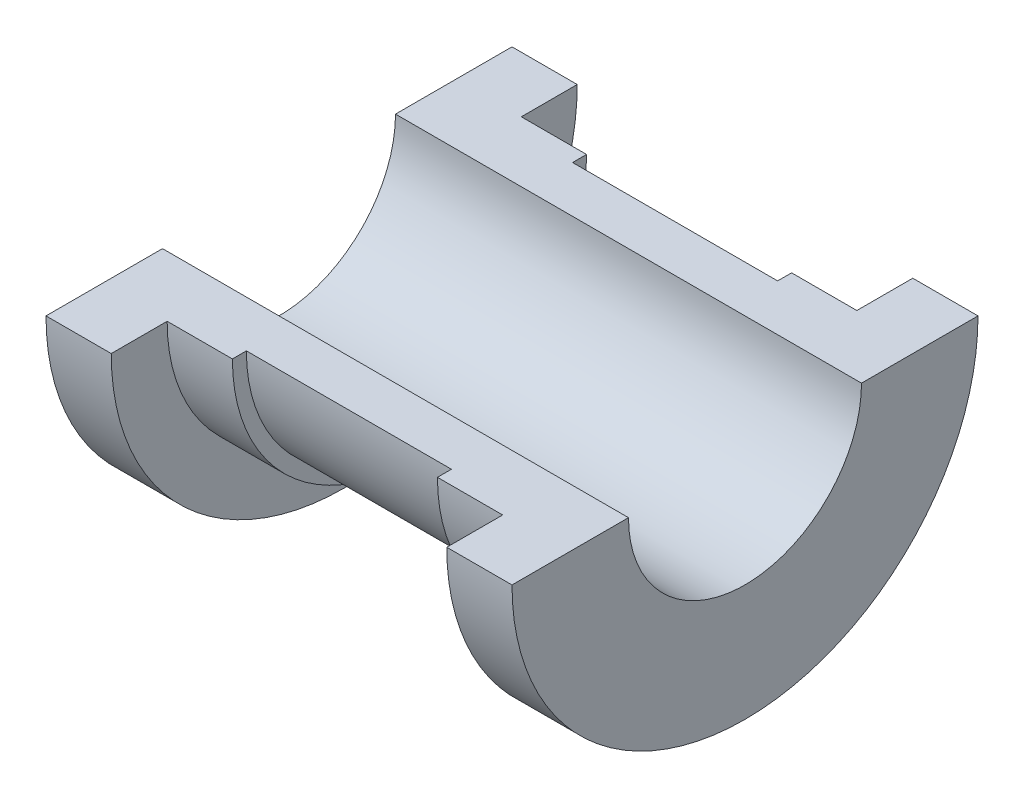
from build123d import *

# Parameters (mm, degrees)
SKETCH2_R               = 12.5
CUT_EXTRUDE1_DEPTH      = 62.23724357
CUT_EXTRUDE4_DEPTH      = 62.23724357
CUT_EXTRUDE4_DEPTH_BACK = 62.23724357
SKETCH5_R               = 3
BOSS_EXTRUDE1_DEPTH     = 5


with BuildPart() as part:
    # Sketch1 → Revolve1 (revolve)
    with BuildSketch(Plane.XY, mode=Mode.PRIVATE) as revolve1_sk:
        Polygon((-25, 0), (25, 0), (25, 25), (18, 25), (18, 19), (11, 19), (11, 17.5), (-11, 17.5), (-11, 19), (-18, 19), (-18, 25), (-25, 25), align=None)
    revolve(revolve1_sk.sketch.rotate(Axis((-25, 0, 0), (1, 0, 0)), 90), axis=Axis((-25, 0, 0), (1, 0, 0)))

    # Sketch2 → Cut-Extrude1 (cut, through all)
    with BuildSketch(Plane(origin=(25, 0, 0), x_dir=(0, 0, -1), z_dir=(1, 0, 0))):
        Circle(SKETCH2_R)
    extrude(amount=-CUT_EXTRUDE1_DEPTH, mode=Mode.SUBTRACT)

    # Sketch3 → Cut-Extrude4 (cut, two sides: drawn at the far end of the back side and taken through both)
    with BuildSketch(Plane(origin=(25, 0, 0), x_dir=(0, 0, -1), z_dir=(1, 0, 0)).offset(-CUT_EXTRUDE4_DEPTH_BACK)):
        Polygon((-146.803398875, 0), (-25, 0), (25, 0), (146.803398875, 0), (146.803398875, 243.60679775), (-146.803398875, 243.60679775), align=None)
    extrude(amount=CUT_EXTRUDE4_DEPTH + CUT_EXTRUDE4_DEPTH_BACK, mode=Mode.SUBTRACT)


with BuildPart() as body_2:
    # Sketch5 → Boss-Extrude1 (new body)
    with BuildSketch(Plane(origin=(0, -17.5, 0), x_dir=(1, 0, 0), z_dir=(0, 1, 0))):
        with Locations(Location((0, 0, 0), (0, 0, 270))):
            Circle(SKETCH5_R)
    extrude(amount=-BOSS_EXTRUDE1_DEPTH)


solid = Compound([part.part, body_2.part])
